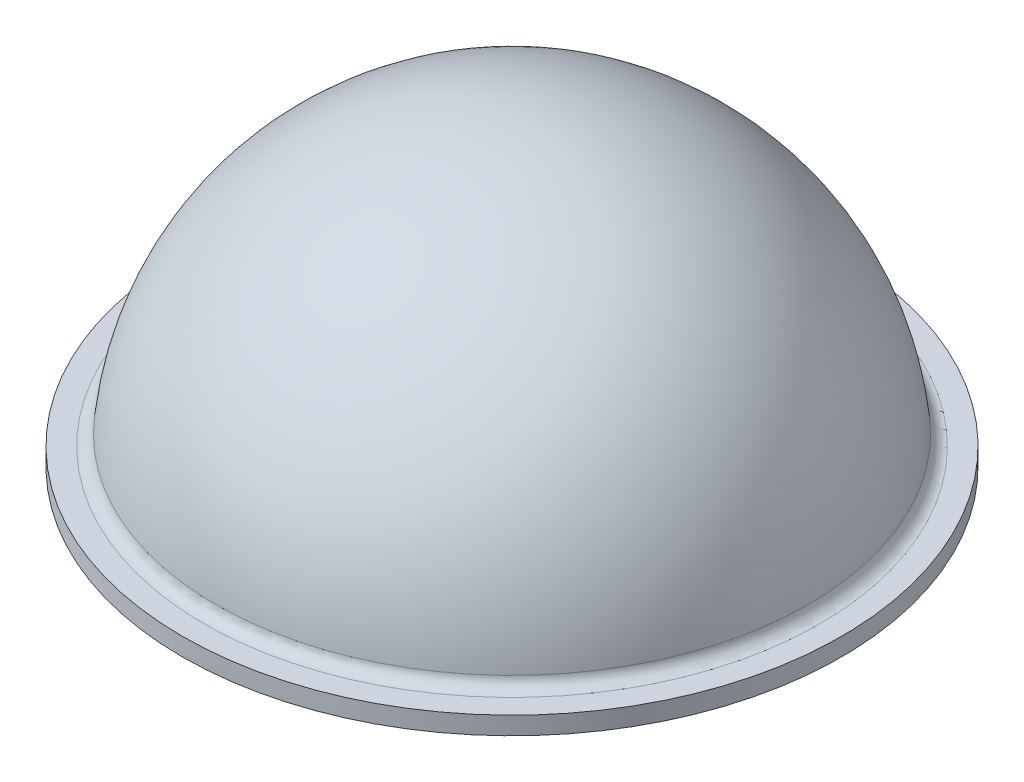
from build123d import *


with BuildPart() as part:
    # Croquis1 → Revolución1 (revolve)
    with BuildSketch(Plane.XY, mode=Mode.PRIVATE) as revoluci_n1_sk:
        with BuildLine():
            Line((49.909918854, 0), (55.409918854, 0))
            Line((55.409918854, 0), (55.409918854, 3))
            Line((55.409918854, 3), (51.759057178, 3))
            ThreePointArc((51.759057178, 3), (50.414552694, 3.51935565), (49.76832421, 4.807692308))
            ThreePointArc((49.76832421, 4.807692308), (33.612612102, 37.016108759), (0, 50))
            Line((0, 50), (0, 47))
            ThreePointArc((0, 47), (32.221576622, 34.21651648), (46.915323723, 2.82))
            ThreePointArc((46.915323723, 2.82), (47.853222474, 0.815967033), (49.909918854, 0))
        make_face()
    revolve(revoluci_n1_sk.sketch.rotate(Axis((0, 0, 0), (0, 1, 0)), 90), axis=Axis((0, 0, 0), (0, 1, 0)))


solid = part.part
